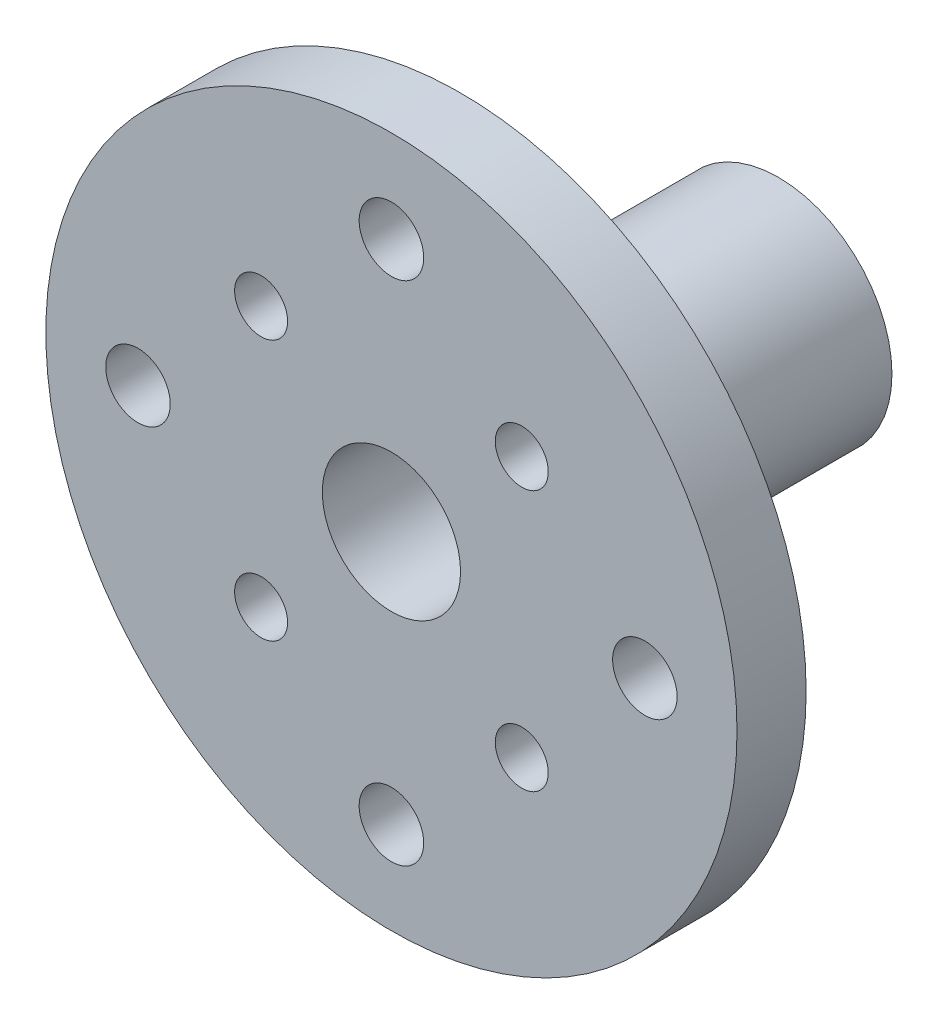
from build123d import *

# Parameters (mm, degrees)
SKETCH_1_R          = 4.925
SKETCH_1_R_2        = 1.55
EXTRUDE_1_DEPTH     = 13.8
SKETCH_2_R          = 15
SKETCH_2_R_2        = 1.4
SKETCH_2_R_3        = 1.15
SKETCH_2_R_4        = 1.55
EXTRUDE_2_DEPTH     = 3
SKETCH_3_R          = 3
CUT_EXTRUDE_1_DEPTH = 10


with BuildPart() as part:
    # 草图1 → 凸台-拉伸1 (new body)
    with BuildSketch(Plane.XY):
        with Locations(Location((0, 0, 0), (0, 0, 180))):
            Circle(SKETCH_1_R)
        with Locations(Location((0, 0, 0), (0, 0, 180))):
            Circle(SKETCH_1_R_2, mode=Mode.SUBTRACT)
    extrude(amount=EXTRUDE_1_DEPTH)

    # 草图2 → 凸台-拉伸2 (add)
    with BuildSketch(Plane.XY.offset(13.8)):
        Circle(SKETCH_2_R)
        with Locations((-11, 0)):
            Circle(SKETCH_2_R_2, mode=Mode.SUBTRACT)
        with Locations((0, 11)):
            Circle(SKETCH_2_R_2, mode=Mode.SUBTRACT)
        with Locations((11, 0)):
            Circle(SKETCH_2_R_2, mode=Mode.SUBTRACT)
        with Locations((0, -11)):
            Circle(SKETCH_2_R_2, mode=Mode.SUBTRACT)
        with Locations((-5.656854249, 5.656854249)):
            Circle(SKETCH_2_R_3, mode=Mode.SUBTRACT)
        with Locations((5.656854249, 5.656854249)):
            Circle(SKETCH_2_R_3, mode=Mode.SUBTRACT)
        with Locations((5.656854249, -5.656854249)):
            Circle(SKETCH_2_R_3, mode=Mode.SUBTRACT)
        with Locations((-5.656854249, -5.656854249)):
            Circle(SKETCH_2_R_3, mode=Mode.SUBTRACT)
        with Locations(Location((0, 0, 0), (0, 0, 180))):
            Circle(SKETCH_2_R_4, mode=Mode.SUBTRACT)
    extrude(amount=EXTRUDE_2_DEPTH)

    # 草图3 → 切除-拉伸1 (cut)
    with BuildSketch(Plane.XY.offset(16.8)):
        Circle(SKETCH_3_R)
    extrude(amount=-CUT_EXTRUDE_1_DEPTH, mode=Mode.SUBTRACT)


solid = part.part
